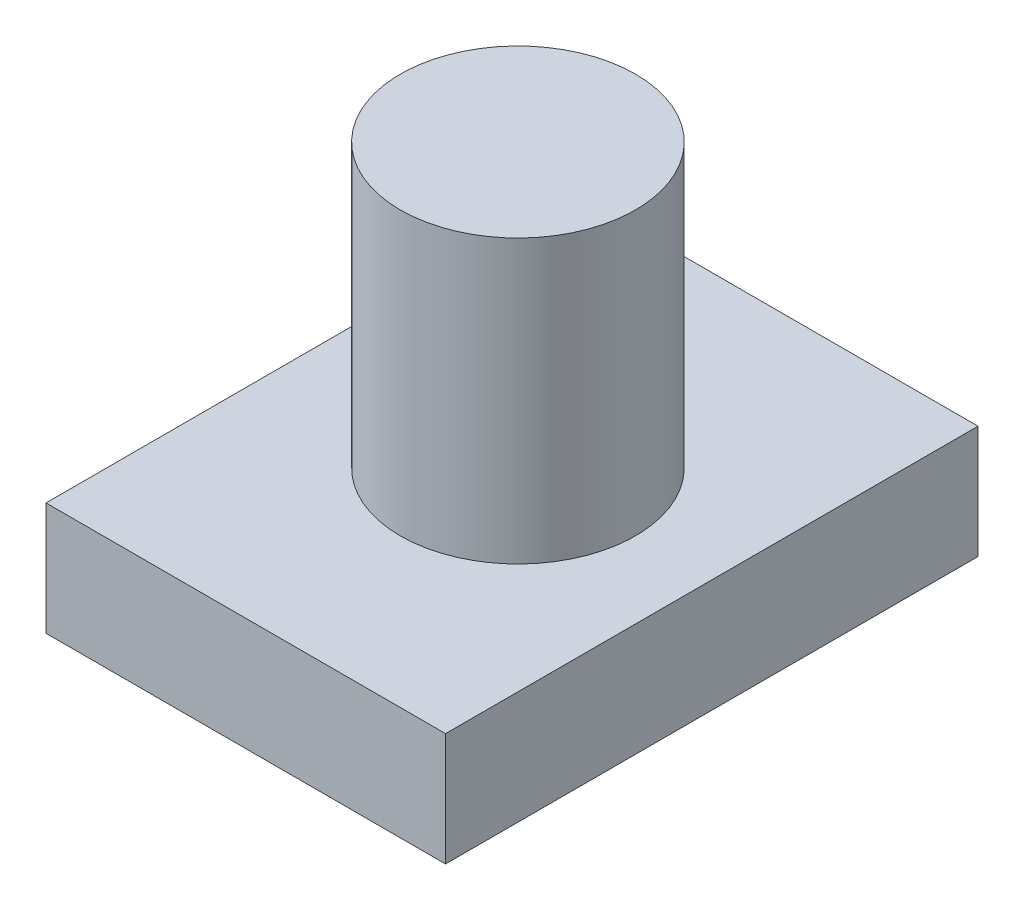
from build123d import *

# Parameters (mm, degrees)
SKETCH_1_R      = 12.5
EXTRUDE_1_DEPTH = 30
SKETCH_2_W      = 42.461745146
SKETCH_2_H      = 56.586214178
EXTRUDE_2_DEPTH = 12


with BuildPart() as part:
    # Эскиз1 → Вытянуть1 (new body)
    with BuildSketch(Plane(origin=(0, 0, 0), x_dir=(1, 0, 0), z_dir=(0, 1, 0))):
        with Locations(Location((0, 0, 0), (0, 0, 270))):
            Circle(SKETCH_1_R)
    extrude(amount=EXTRUDE_1_DEPTH)

    # Эскиз2 → Вытянуть2 (add)
    with BuildSketch(Plane.XZ):
        with Locations((-0.627472581, 0)):
            Rectangle(SKETCH_2_W, SKETCH_2_H)
    extrude(amount=EXTRUDE_2_DEPTH)


solid = part.part
